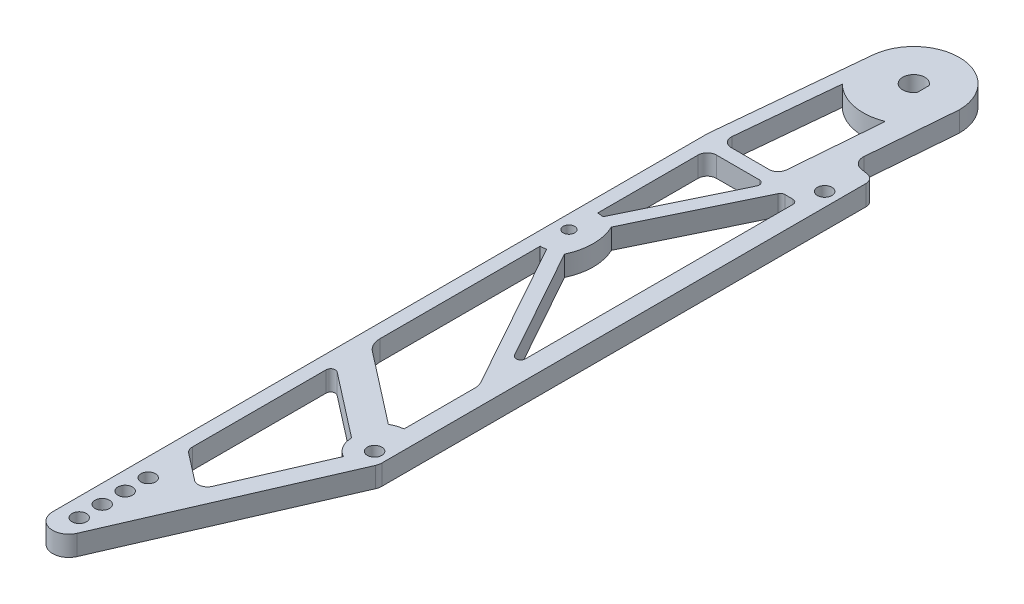
from build123d import *

# Parameters (mm, degrees)
SKETCH2_R           = 2
SKETCH2_R_2         = 1.5875
SKETCH2_R_3         = 1.999999991
BOSS_EXTRUDE1_DEPTH = 5.588


with BuildPart() as part:
    # Sketch2 → Boss-Extrude1 (new body)
    with BuildSketch(Plane(origin=(0, 0, 0), x_dir=(1, 0, 0), z_dir=(0, 1, 0))):
        with BuildLine():
            ThreePointArc((17.295902343, -30.526810701), (16.688093876, -28.878103365), (15.15555913, -28.018449791))
            Line((15.15555913, -28.018449791), (13.238676936, -27.713033224))
            ThreePointArc((13.238676936, -27.713033224), (11.241051513, -26.538356195), (10.573787778, -24.319092227))
            Line((10.573787778, -24.319092227), (12.5603, 0))
            ThreePointArc((12.5603, 0), (0.603657177, 12.545785512), (-12.502275592, 1.2059192))
            Line((-12.502275592, 1.2059192), (-16.498266045, -40.222207921))
            ThreePointArc((-16.498266045, -40.222207921), (-16.507064815, -40.344000039), (-16.51, -40.466074291))
            Line((-16.51, -40.466074291), (-16.51, -221.328861788))
            ThreePointArc((-16.51, -221.328861788), (-12.970187584, -225.680718913), (-7.988667969, -223.101301399))
            Line((-7.988667969, -223.101301399), (16.979901226, -165.677523619))
            ThreePointArc((16.979901226, -165.677523619), (17.216065593, -164.934164738), (17.295902343, -164.158289667))
            Line((17.295902343, -164.158289667), (17.295902343, -30.526810701))
        make_face()
        with Locations(Location((-11.43, -219.075, 0), (0, 0, 270))):
            Circle(SKETCH2_R, mode=Mode.SUBTRACT)
        with Locations(Location((-11.43, -212.725, 0), (0, 0, 270))):
            Circle(SKETCH2_R, mode=Mode.SUBTRACT)
        with Locations(Location((-11.43, -206.375, 0), (0, 0, 270))):
            Circle(SKETCH2_R, mode=Mode.SUBTRACT)
        with Locations(Location((-11.43, -200.025, 0), (0, 0, 270))):
            Circle(SKETCH2_R, mode=Mode.SUBTRACT)
        with BuildLine():
            ThreePointArc((7.135902343, -162.410770806), (8.023611961, -165.648962244), (10.438542905, -167.981776143))
            Line((10.438542905, -167.981776143), (-0.534170778, -193.217289931))
            ThreePointArc((-0.534170778, -193.217289931), (-2.234040931, -194.665234867), (-4.420389569, -194.211381682))
            Line((-4.420389569, -194.211381682), (-11.716886202, -188.551043102))
            ThreePointArc((-11.716886202, -188.551043102), (-12.441018517, -187.661516081), (-12.7, -186.544128716))
            Line((-12.7, -186.544128716), (-12.7, -149.615408258))
            ThreePointArc((-12.7, -149.615408258), (-11.988693683, -148.474898999), (-10.651556899, -148.611951065))
            Line((-10.651556899, -148.611951065), (7.135902343, -162.410770806))
        make_face(mode=Mode.SUBTRACT)
        with BuildLine():
            ThreePointArc((12.215902343, -152.970817152), (10.520298026, -153.359206519), (8.923603828, -154.049487576))
            Line((8.923603828, -154.049487576), (-10.733772403, -138.80005889))
            ThreePointArc((-10.733772403, -138.80005889), (-12.182037035, -137.021004847), (-12.7, -134.786230117))
            Line((-12.7, -134.786230117), (-12.7, -90.4875))
            ThreePointArc((-12.7, -90.4875), (-11.888769677, -90.445936399), (-11.086035141, -90.321680879))
            Line((-11.086035141, -90.321680879), (11.575760855, -131.079432803))
            ThreePointArc((11.575760855, -131.079432803), (12.053263487, -132.272915946), (12.215902343, -133.548047069))
            Line((12.215902343, -133.548047069), (12.215902343, -152.970817152))
        make_face(mode=Mode.SUBTRACT)
        with Locations(Location((13.485902343, -162.410770806, 0), (0, 0, 270))):
            Circle(SKETCH2_R, mode=Mode.SUBTRACT)
        with Locations(Location((-12.7, -82.55, 0), (0, 0, 270))):
            Circle(SKETCH2_R_2, mode=Mode.SUBTRACT)
        with BuildLine():
            Line((-10.16, -44.337182032), (1.663048834, -44.337182032))
            ThreePointArc((1.663048834, -44.337182032), (2.739129831, -44.932682449), (2.806066447, -46.160725831))
            Line((2.806066447, -46.160725831), (-11.055993219, -74.784618621))
            ThreePointArc((-11.055993219, -74.784618621), (-11.873503915, -74.655646925), (-12.7, -74.6125))
            Line((-12.7, -74.6125), (-12.7, -46.877182032))
            ThreePointArc((-12.7, -46.877182032), (-11.956051224, -45.081130808), (-10.16, -44.337182032))
        make_face(mode=Mode.SUBTRACT)
        with BuildLine():
            ThreePointArc((-9.903213406, -40.527182032), (-11.783508673, -39.694838236), (-12.431479451, -37.743315662))
            Line((-12.431479451, -37.743315662), (-9.755434212, -9.99962016))
            ThreePointArc((-9.755434212, -9.99962016), (-2.756273581, -13.695395429), (5.127655889, -12.99492382))
            Line((5.127655889, -12.99492382), (3.069264048, -38.19397392))
            ThreePointArc((3.069264048, -38.19397392), (2.259083254, -39.854914801), (0.537695935, -40.527182032))
            Line((0.537695935, -40.527182032), (-9.903213406, -40.527182032))
        make_face(mode=Mode.SUBTRACT)
        with BuildLine():
            ThreePointArc((2.6, -1.594521872), (-3.05, 0), (2.6, 1.594521872))
            Line((2.6, 1.594521872), (2.6, -1.594521872))
        make_face(mode=Mode.SUBTRACT)
        with BuildLine():
            ThreePointArc((-7.44734835, -89.025591197), (-5.976040897, -82.55), (-7.44734835, -76.074408803))
            Line((-7.44734835, -76.074408803), (7.575478058, -45.053638233))
            ThreePointArc((7.575478058, -45.053638233), (8.043996088, -44.531101035), (8.718495671, -44.337182032))
            Line((8.718495671, -44.337182032), (10.945902343, -44.337182032))
            ThreePointArc((10.945902343, -44.337182032), (11.843927955, -44.70915642), (12.215902343, -45.607182032))
            Line((12.215902343, -45.607182032), (12.215902343, -119.492817968))
            ThreePointArc((12.215902343, -119.492817968), (11.264685124, -120.722158254), (9.835937715, -120.109971535))
            Line((9.835937715, -120.109971535), (-7.44734835, -89.025591197))
        make_face(mode=Mode.SUBTRACT)
        with Locations(Location((13.485902343, -38.1, 0), (0, 0, 270))):
            Circle(SKETCH2_R_3, mode=Mode.SUBTRACT)
    extrude(amount=BOSS_EXTRUDE1_DEPTH)


solid = part.part
